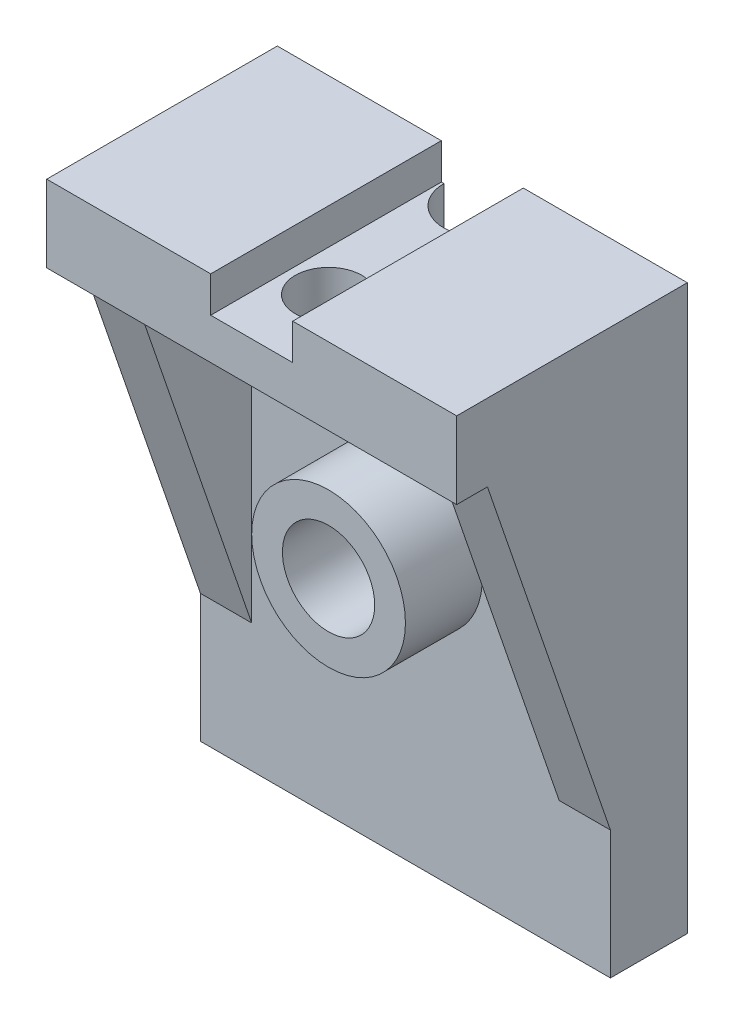
from build123d import *

# Parameters (mm, degrees)
SKETCH_1_W          = 80
SKETCH_1_H          = 110
EXTRUDE_1_DEPTH     = 15
SKETCH_2_W          = 80
SKETCH_2_H          = 15
EXTRUDE_2_DEPTH     = 30
EXTRUDE_3_DEPTH     = 10
SKETCH_4_R          = 15
EXTRUDE_4_DEPTH     = 15
SKETCH_5_R          = 9
CUT_EXTRUDE_1_DEPTH = 75.330343737
SKETCH_6_R          = 6.5
CUT_EXTRUDE_2_DEPTH = 113.472218792
SKETCH_7_R          = 7.5
CUT_EXTRUDE_3_DEPTH = 126.39936204
SKETCH_8_W          = 16
SKETCH_8_H          = 7
CUT_EXTRUDE_4_DEPTH = 82.547532274


with BuildPart() as part:
    # Эскиз1 → Бобышка-Вытянуть1 (new body)
    with BuildSketch(Plane.XY):
        Rectangle(SKETCH_1_W, SKETCH_1_H)
    extrude(amount=EXTRUDE_1_DEPTH)

    # Эскиз2 → Бобышка-Вытянуть2 (add)
    with BuildSketch(Plane.XY.offset(15)):
        with Locations((0, 47.5)):
            Rectangle(SKETCH_2_W, SKETCH_2_H)
    extrude(amount=EXTRUDE_2_DEPTH)

    # Эскиз3 → Бобышка-Вытянуть3 (add)
    with BuildSketch(Plane(origin=(40, 0, 0), x_dir=(0, 0, -1), z_dir=(1, 0, 0))):
        Polygon((-39, 40), (-15, -30), (-15, 40), align=None)
    extrude_3 = extrude(amount=-EXTRUDE_3_DEPTH)

    # Зеркальное отражение1: Бобышка-Вытянуть3 across plane
    add(extrude_3.mirror(Plane(origin=(0, 0, 0), x_dir=(0, 0, 1), z_dir=(1, 0, 0))))

    # Эскиз4 → Бобышка-Вытянуть4 (add)
    with BuildSketch(Plane.XY.offset(15)):
        with Locations(Location((0, 0, 0), (0, 0, 180))):
            Circle(SKETCH_4_R)
    extrude(amount=EXTRUDE_4_DEPTH)

    # Эскиз5 → Вырез-Вытянуть1 (cut, through all)
    with BuildSketch(Plane.XY.offset(30)):
        Circle(SKETCH_5_R)
    extrude(amount=-CUT_EXTRUDE_1_DEPTH, mode=Mode.SUBTRACT)

    # Эскиз6 → Вырез-Вытянуть2 (cut, through all)
    with BuildSketch(Plane.XZ.offset(-40)):
        with Locations((0, 30)):
            Circle(SKETCH_6_R)
    extrude(amount=-CUT_EXTRUDE_2_DEPTH, mode=Mode.SUBTRACT)

    # Эскиз7 → Вырез-Вытянуть3 (cut, through all)
    with BuildSketch(Plane.XZ.offset(55)):
        Circle(SKETCH_7_R)
    extrude(amount=-CUT_EXTRUDE_3_DEPTH, mode=Mode.SUBTRACT)

    # Эскиз8 → Вырез-Вытянуть4 (cut, through all)
    with BuildSketch(Plane.XY.offset(45)):
        with Locations((0, 51.5)):
            Rectangle(SKETCH_8_W, SKETCH_8_H)
    extrude(amount=-CUT_EXTRUDE_4_DEPTH, mode=Mode.SUBTRACT)


solid = part.part
